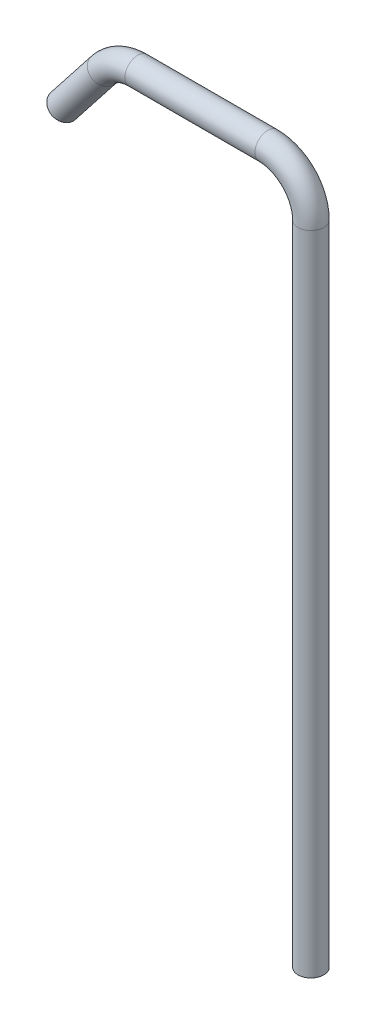
from build123d import *

# Parameters (mm, degrees)
SKETCH2_R           = 3
SKETCH4_R           = 3
BOSS_EXTRUDE1_DEPTH = 30
SKETCH5_R           = 3
BOSS_EXTRUDE2_DEPTH = 20


with BuildPart() as part:
    # Sweep1: sweep along a path in Sketch1
    with BuildLine(Plane.XY) as sweep1_path:
        Line((0, 0), (0, 100))
        ThreePointArc((0, 100), (-2.928932188, 107.071067812), (-10, 110))
        Line((-10, 110), (-40.137832809, 110))
        ThreePointArc((-40.137832809, 110), (-44.510528091, 108.993305064), (-48.002829333, 106.175907194))
        Line((-48.002829333, 106.175907194), (-57.405523913, 94.201608056))
    # Sketch2 → Sweep1 (sweep)
    with BuildSketch(Plane(origin=(0, 0, 0), x_dir=(1, 0, 0), z_dir=(0, 1, 0))):
        Circle(SKETCH2_R)
    sweep(path=sweep1_path.line)

    # Sketch4 → Boss-Extrude1 (add)
    with BuildSketch(Plane.XZ):
        Circle(SKETCH4_R)
    extrude(amount=BOSS_EXTRUDE1_DEPTH)

    # Sketch5 → Boss-Extrude2 (add)
    with BuildSketch(Plane.XZ.offset(30)):
        Circle(SKETCH5_R)
    extrude(amount=BOSS_EXTRUDE2_DEPTH)


solid = part.part
